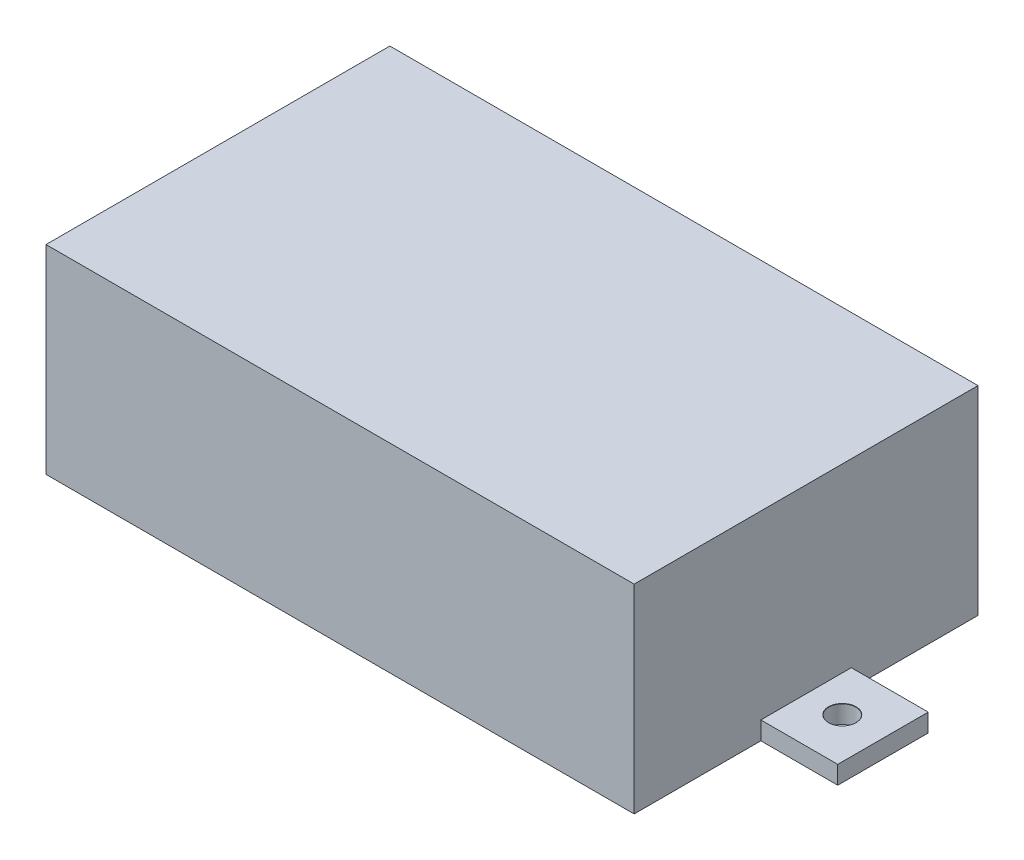
from build123d import *

# Parameters (mm, degrees)
SKETCH1_W                          = 65
SKETCH1_H                          = 38
BOSS_EXTRUDE1_DEPTH                = 22
SKETCH2_W                          = 82
SKETCH2_H                          = 10
BOSS_EXTRUDE2_DEPTH                = 2
F_3_0_3_DIAMETER_HOLE1_D           = 3
F_3_0_3_DIAMETER_HOLE1_CSINK_D     = 3.05
F_3_0_3_DIAMETER_HOLE1_CSINK_ANGLE = 90


with BuildPart() as part:
    # Sketch1 → Boss-Extrude1 (new body)
    with BuildSketch(Plane(origin=(0, 0, 0), x_dir=(1, 0, 0), z_dir=(0, 1, 0))):
        Rectangle(SKETCH1_W, SKETCH1_H)
    extrude(amount=BOSS_EXTRUDE1_DEPTH)

    # Sketch2 → Boss-Extrude2 (add)
    with BuildSketch(Plane.XZ):
        Rectangle(SKETCH2_W, SKETCH2_H)
    extrude(amount=-BOSS_EXTRUDE2_DEPTH)

    # Ø3.0 (3) Diameter Hole1 (through all)
    with Locations(Plane(origin=(0, 2, 0), x_dir=(1, 0, 0), z_dir=(0, 1, 0))):
        with Locations((-36.5, 0), (36.5, 0)):
            CounterSinkHole(F_3_0_3_DIAMETER_HOLE1_D / 2, F_3_0_3_DIAMETER_HOLE1_CSINK_D / 2, counter_sink_angle=F_3_0_3_DIAMETER_HOLE1_CSINK_ANGLE)


solid = part.part
